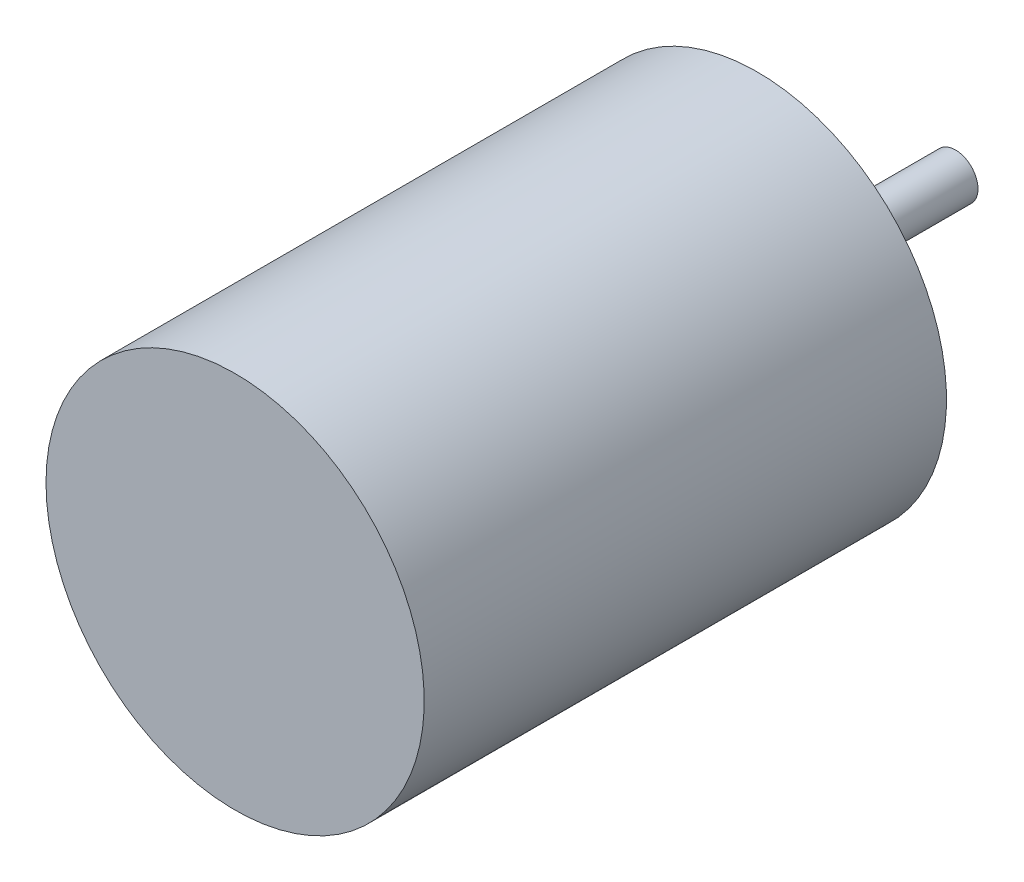
from build123d import *

# Parameters (mm, degrees)
SKETCH1_R         = 21
EXTRUDE_296_DEPTH = 58
SKETCH2_R         = 2.5
EXTRUDE_387_DEPTH = 22


with BuildPart() as part:
    # Sketch1 → Extrude 296 (new body)
    with BuildSketch(Plane.XY):
        with Locations(Location((75.771006381, -68.582665129, 0), (0, 0, 180))):
            Circle(SKETCH1_R)
    extrude(amount=EXTRUDE_296_DEPTH)

    # Sketch2 → Extrude 387 (add)
    with BuildSketch(Plane(origin=(0, 0, 0), x_dir=(-1, 0, 0), z_dir=(0, 0, -1))):
        with Locations(Location((-75.771006381, -68.582665129, 0), (0, 0, 180))):
            Circle(SKETCH2_R)
    extrude(amount=EXTRUDE_387_DEPTH)


solid = part.part
